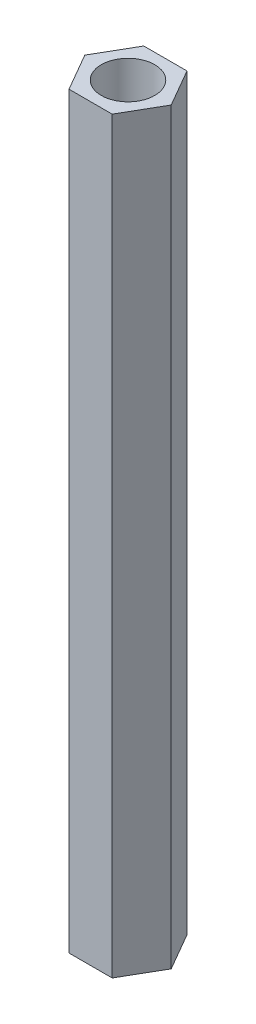
from build123d import *

# Parameters (mm, degrees)
SKETCH_1_R      = 2.5
EXTRUDE_1_DEPTH = 70


with BuildPart() as part:
    # 草图1 → 凸台-拉伸1 (new body)
    with BuildSketch(Plane(origin=(0, 0, 0), x_dir=(1, 0, 0), z_dir=(0, 1, 0))):
        Polygon((2.020725942, -3.5), (4.041451884, 0), (2.020725942, 3.5), (-2.020725942, 3.5), (-4.041451884, 0), (-2.020725942, -3.5), align=None)
        with Locations(Location((0, 0, 0), (0, 0, 270))):
            Circle(SKETCH_1_R, mode=Mode.SUBTRACT)
    extrude(amount=EXTRUDE_1_DEPTH)


solid = part.part
